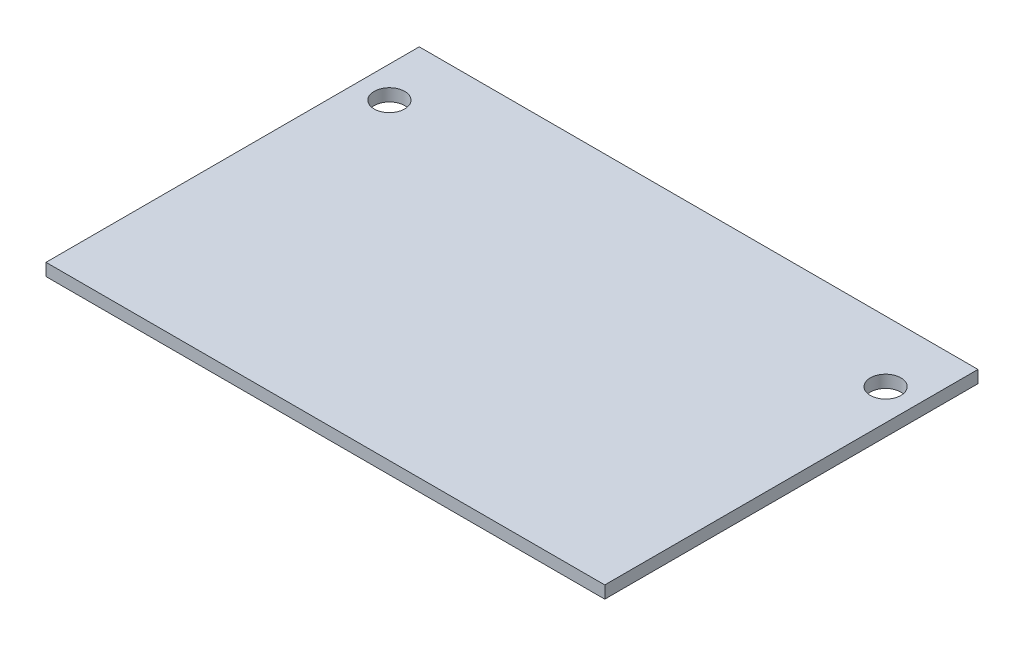
from build123d import *

# Parameters (mm, degrees)
SKETCH1_W           = 76.8
SKETCH1_H           = 51.3
BOSS_EXTRUDE1_DEPTH = 1.7
SKETCH2_R           = 2.1
CUT_EXTRUDE1_DEPTH  = 47.210090889


with BuildPart() as part:
    # Sketch1 → Boss-Extrude1 (new body)
    with BuildSketch(Plane(origin=(0, 0, 0), x_dir=(1, 0, 0), z_dir=(0, 1, 0))):
        Rectangle(SKETCH1_W, SKETCH1_H)
    extrude(amount=BOSS_EXTRUDE1_DEPTH)

    # Sketch2 → Cut-Extrude1 (cut, through all)
    with BuildSketch(Plane(origin=(0, 1.7, 0), x_dir=(1, 0, 0), z_dir=(0, 1, 0))):
        with Locations(Location((34.1, 17.25, 0), (0, 0, 270))):
            Circle(SKETCH2_R)
        with Locations(Location((-34.1, 17.25, 0), (0, 0, 90))):
            Circle(SKETCH2_R)
    extrude(amount=-CUT_EXTRUDE1_DEPTH, mode=Mode.SUBTRACT)


solid = part.part
